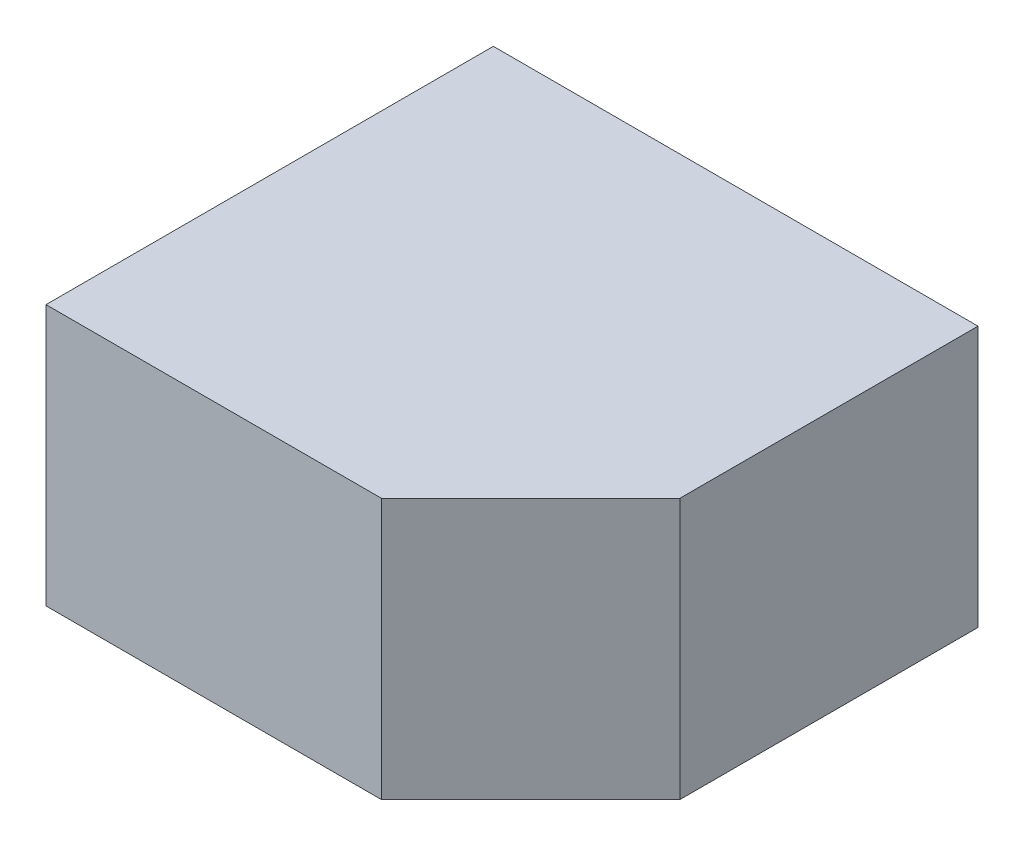
from build123d import *

# Parameters (mm, degrees)
SKETCH_1_W          = 503
SKETCH_1_H          = 558
EXTRUDE_1_DEPTH     = 865
SKETCH_2_W          = 200
SKETCH_2_H          = 398
CUT_EXTRUDE_1_DEPTH = 1039.785348376
SKETCH_3_W          = 94
SKETCH_3_H          = 148
CUT_EXTRUDE_2_DEPTH = 1039.785348376
SKETCH_5_W          = 650
SKETCH_5_H          = 350
EXTRUDE_3_DEPTH     = 600
CHAMFER_1_SIZE      = 200
SKETCH_6_W          = 1000
SKETCH_6_H          = 4830
EXTRUDE_4_DEPTH     = 30
SKETCH_7_W          = 625.774769939
SKETCH_7_H          = 5017.85714808
CUT_EXTRUDE_3_DEPTH = 3931.092365327
SKETCH_8_W          = 1324.574856274
SKETCH_8_H          = 1226.736940753
CUT_EXTRUDE_4_DEPTH = 1300.413329161


with BuildPart() as part:
    # 草图1 → 凸台-拉伸1 (new body)
    with BuildSketch(Plane.XY):
        Rectangle(SKETCH_1_W, SKETCH_1_H)
    extrude(amount=EXTRUDE_1_DEPTH)

    # 草图2 → 切除-拉伸1 (cut, through all)
    with BuildSketch(Plane(origin=(251.5, 0, 0), x_dir=(0, 0, -1), z_dir=(1, 0, 0))):
        Rectangle(SKETCH_2_W, SKETCH_2_H)
    extrude(amount=-CUT_EXTRUDE_1_DEPTH, mode=Mode.SUBTRACT)

    # 草图3 → 切除-拉伸2 (cut, through all)
    with BuildSketch(Plane(origin=(251.5, 0, 0), x_dir=(0, 0, -1), z_dir=(1, 0, 0))):
        with Locations((-53, -279)):
            Rectangle(SKETCH_3_W, SKETCH_3_H)
    cut_extrude_2 = extrude(amount=-CUT_EXTRUDE_2_DEPTH, mode=Mode.SUBTRACT)

    # 镜向1: 切除-拉伸2 across plane
    add(cut_extrude_2.mirror(Plane.ZX), mode=Mode.SUBTRACT)

    # 草图8 → 切除-拉伸4 (cut, through all)
    with BuildSketch(Plane(origin=(251.5, 0, 0), x_dir=(0, 0, -1), z_dir=(1, 0, 0))):
        with Locations((-463.569646277, -264.855691223)):
            Rectangle(SKETCH_8_W, SKETCH_8_H)
    extrude(amount=-CUT_EXTRUDE_4_DEPTH, mode=Mode.SUBTRACT)


with BuildPart() as body_2:
    # 草图5 → 凸台-拉伸3 (new body)
    with BuildSketch(Plane(origin=(0, 0, 0), x_dir=(-1, 0, 0), z_dir=(0, 0, -1))):
        with Locations((-73.5, 654)):
            Rectangle(SKETCH_5_W, SKETCH_5_H)
    extrude(amount=-EXTRUDE_3_DEPTH)

    # 倒角1
    chamfer_1_edges = [body_2.edges().sort_by_distance(p)[0] for p in [
        (398.5, 654, 600),
    ]]
    chamfer(chamfer_1_edges, length=CHAMFER_1_SIZE)


with BuildPart() as body_3:
    # 草图6 → 凸台-拉伸4 (new body)
    with BuildSketch(Plane(origin=(0, 0, 0), x_dir=(-1, 0, 0), z_dir=(0, 0, -1))):
        with Locations((-248.5, -1286)):
            Rectangle(SKETCH_6_W, SKETCH_6_H)
    extrude(amount=EXTRUDE_4_DEPTH)

    # 草图7 → 切除-拉伸3 (cut, through all)
    with BuildSketch(Plane(origin=(748.5, 0, 0), x_dir=(0, 0, -1), z_dir=(1, 0, 0))):
        with Locations((312.88738497, -1379.92857404)):
            Rectangle(SKETCH_7_W, SKETCH_7_H)
    extrude(amount=-CUT_EXTRUDE_3_DEPTH, mode=Mode.SUBTRACT)


solid = body_2.part
